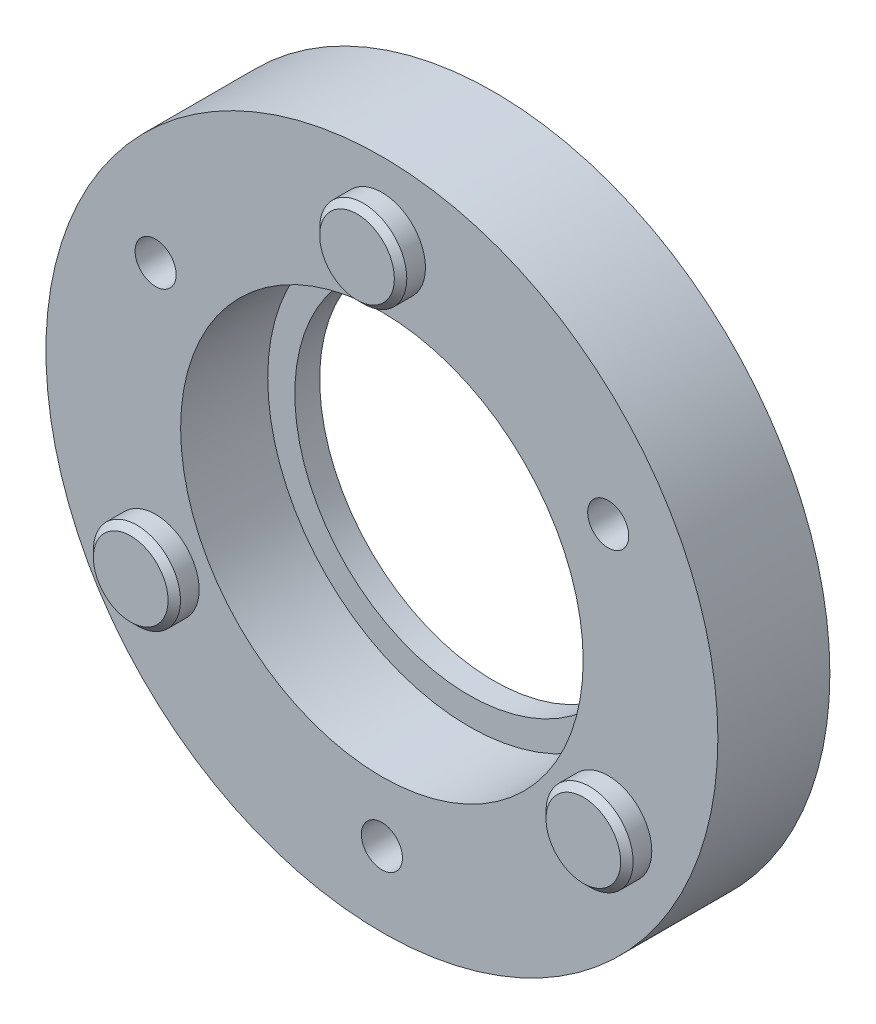
from build123d import *

# Parameters (mm, degrees)
SKETCH_1_R            = 27
EXTRUDE_360_DEPTH     = 9
SKETCH_2_R            = 16.175
CUT_EXTRUDE_445_DEPTH = 7
SKETCH_3_R            = 14
CUT_EXTRUDE_528_DEPTH = 39.820097888
SKETCH_4_R            = 1.65
CUT_EXTRUDE_687_DEPTH = 40.230090492
SKETCH_6_R            = 3.65
CUT_EXTRUDE_894_DEPTH = 3
SKETCH_7_R            = 3.5
EXTRUDE_1085_DEPTH    = 2
CHAMFER_1_SIZE        = 0.5


with BuildPart() as part:
    # Эскиз1 → Extrude 360 (new body)
    with BuildSketch(Plane.XY):
        Circle(SKETCH_1_R)
    extrude(amount=EXTRUDE_360_DEPTH)

    # Эскиз2 → Cut-Extrude 445 (cut)
    with BuildSketch(Plane.XY.offset(9)):
        Circle(SKETCH_2_R)
    extrude(amount=-CUT_EXTRUDE_445_DEPTH, mode=Mode.SUBTRACT)

    # Эскиз3 → Cut-Extrude 528 (cut, through all)
    with BuildSketch(Plane.XY.offset(2)):
        Circle(SKETCH_3_R)
    extrude(amount=-CUT_EXTRUDE_528_DEPTH, mode=Mode.SUBTRACT)

    # Эскиз4 → Cut-Extrude 687 (cut, through all)
    with BuildSketch(Plane.XY.offset(9)):
        with Locations((-18.186533479, 10.5)):
            Circle(SKETCH_4_R)
        with Locations((18.186533479, 10.5)):
            Circle(SKETCH_4_R)
        with Locations((0, -21)):
            Circle(SKETCH_4_R)
    extrude(amount=-CUT_EXTRUDE_687_DEPTH, mode=Mode.SUBTRACT)

    # Эскиз6 → Cut-Extrude 894 (cut)
    with BuildSketch(Plane(origin=(0, 0, 0), x_dir=(-1, 0, 0), z_dir=(0, 0, -1))):
        with Locations((0, 21)):
            Circle(SKETCH_6_R)
        with Locations((-18.186533479, -10.5)):
            Circle(SKETCH_6_R)
        with Locations((18.186533479, -10.5)):
            Circle(SKETCH_6_R)
    extrude(amount=-CUT_EXTRUDE_894_DEPTH, mode=Mode.SUBTRACT)

    # Эскиз7 → Extrude 1085 (add)
    with BuildSketch(Plane.XY.offset(9)):
        with Locations((0, 21)):
            Circle(SKETCH_7_R)
        with Locations((-18.186533479, -10.5)):
            Circle(SKETCH_7_R)
        with Locations((18.186533479, -10.5)):
            Circle(SKETCH_7_R)
    extrude(amount=EXTRUDE_1085_DEPTH)

    # Фаска1
    chamfer_1_edges = [part.edges().sort_by_distance(p)[0] for p in [
        (-3.5, 21, 11),
        (-21.686533479, -10.5, 11),
        (14.686533479, -10.5, 11),
    ]]
    chamfer(chamfer_1_edges, length=CHAMFER_1_SIZE)


solid = part.part
